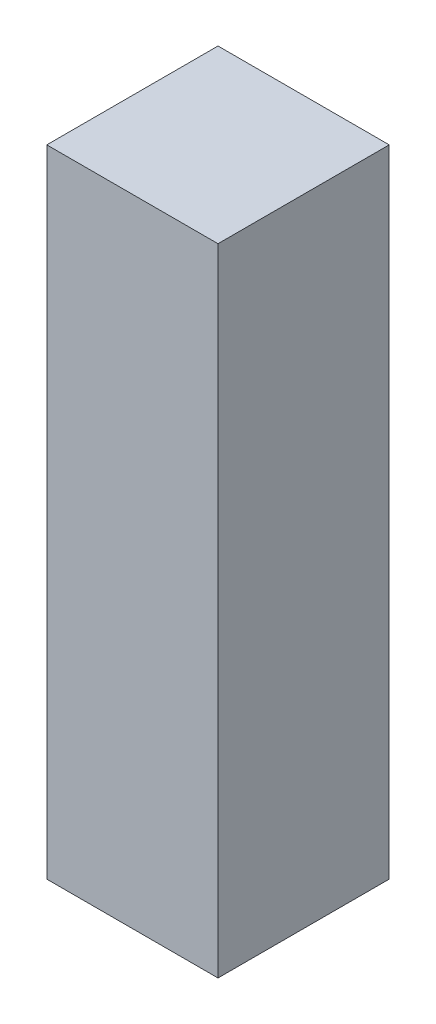
from build123d import *

# Parameters (mm, degrees)
SKETCH1_W           = 88.9
SKETCH1_H           = 88.9
BOSS_EXTRUDE1_DEPTH = 330.2


with BuildPart() as part:
    # Sketch1 → Boss-Extrude1 (new body)
    with BuildSketch(Plane(origin=(0, 0, 0), x_dir=(1, 0, 0), z_dir=(0, 1, 0))):
        with Locations((44.45, 44.45)):
            Rectangle(SKETCH1_W, SKETCH1_H)
    extrude(amount=BOSS_EXTRUDE1_DEPTH)


solid = part.part
